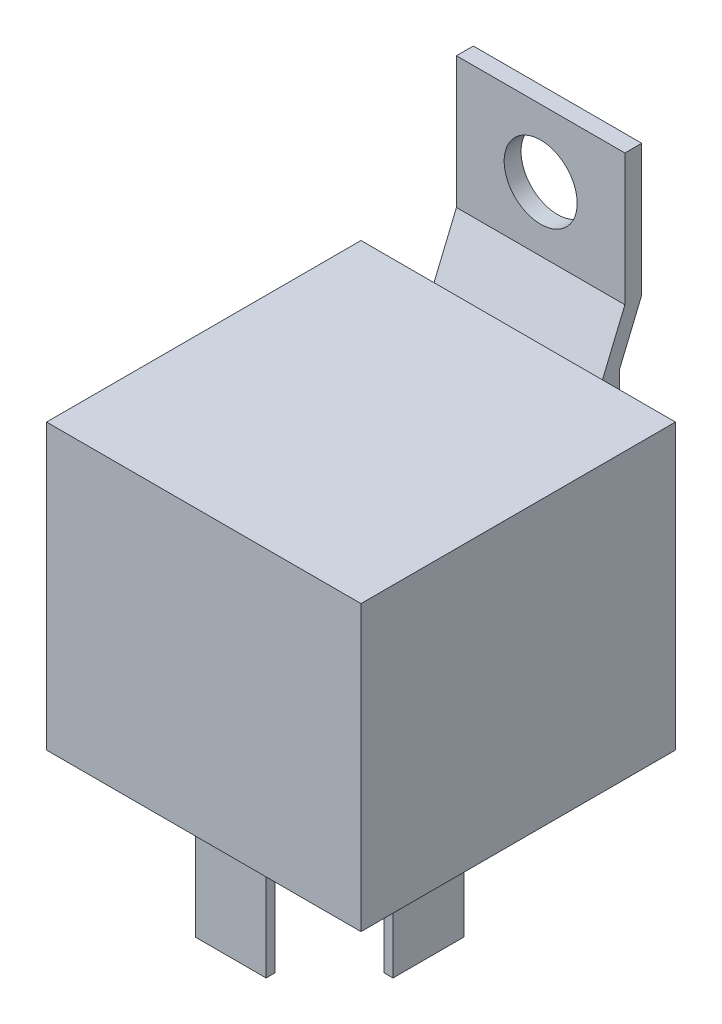
from build123d import *

# Parameters (mm, degrees)
ESQUISSE1_W             = 28
ESQUISSE1_H             = 25.3
BOSS_EXTRU_1_DEPTH      = 28
BOSS_EXTRU_2_DEPTH      = 7.5
ESQUISSE3_R             = 3.25
ENL_V_MAT_EXTRU_1_DEPTH = 45.110344592
ESQUISSE4_W             = 0.8
ESQUISSE4_H             = 6.3
ESQUISSE4_W_2           = 6.3
ESQUISSE4_H_2           = 0.8
BOSS_EXTRU_3_DEPTH      = 10.2


with BuildPart() as part:
    # Esquisse1 → Boss.-Extru.1 (new body)
    with BuildSketch(Plane.XY):
        Rectangle(ESQUISSE1_W, ESQUISSE1_H)
    extrude(amount=BOSS_EXTRU_1_DEPTH)

    # Esquisse2 → Boss.-Extru.2 (add, symmetric)
    with BuildSketch(Plane(origin=(0, 0, 0), x_dir=(0, 0, -1), z_dir=(1, 0, 0))):
        Polygon((0, 12.65), (2, 17.44649219), (2, 29.15), (3.5, 29.15), (3.5, 17.44649219), (1.5, 12.65), (1.5, -3.073931528), (0, -3.073931528), align=None)
    extrude(amount=BOSS_EXTRU_2_DEPTH, both=True)

    # Esquisse3 → Enlèv. mat.-Extru.1 (cut, through all)
    with BuildSketch(Plane.XY.offset(-2)):
        with Locations((0, 23.15)):
            Circle(ESQUISSE3_R)
    extrude(amount=-ENL_V_MAT_EXTRU_1_DEPTH, mode=Mode.SUBTRACT)

    # Esquisse4 → Boss.-Extru.3 (add)
    with BuildSketch(Plane.XZ.offset(12.65)):
        with Locations((8.4, 16.8)):
            Rectangle(ESQUISSE4_W, ESQUISSE4_H)
        with Locations((0, 7.3)):
            Rectangle(ESQUISSE4_W, ESQUISSE4_H)
        with Locations((0, 25.2)):
            Rectangle(ESQUISSE4_W_2, ESQUISSE4_H_2)
        with Locations((-8.4, 16.8)):
            Rectangle(ESQUISSE4_W, ESQUISSE4_H)
        with Locations((0, 17.2)):
            Rectangle(ESQUISSE4_W_2, ESQUISSE4_H_2)
    extrude(amount=BOSS_EXTRU_3_DEPTH)


solid = part.part
